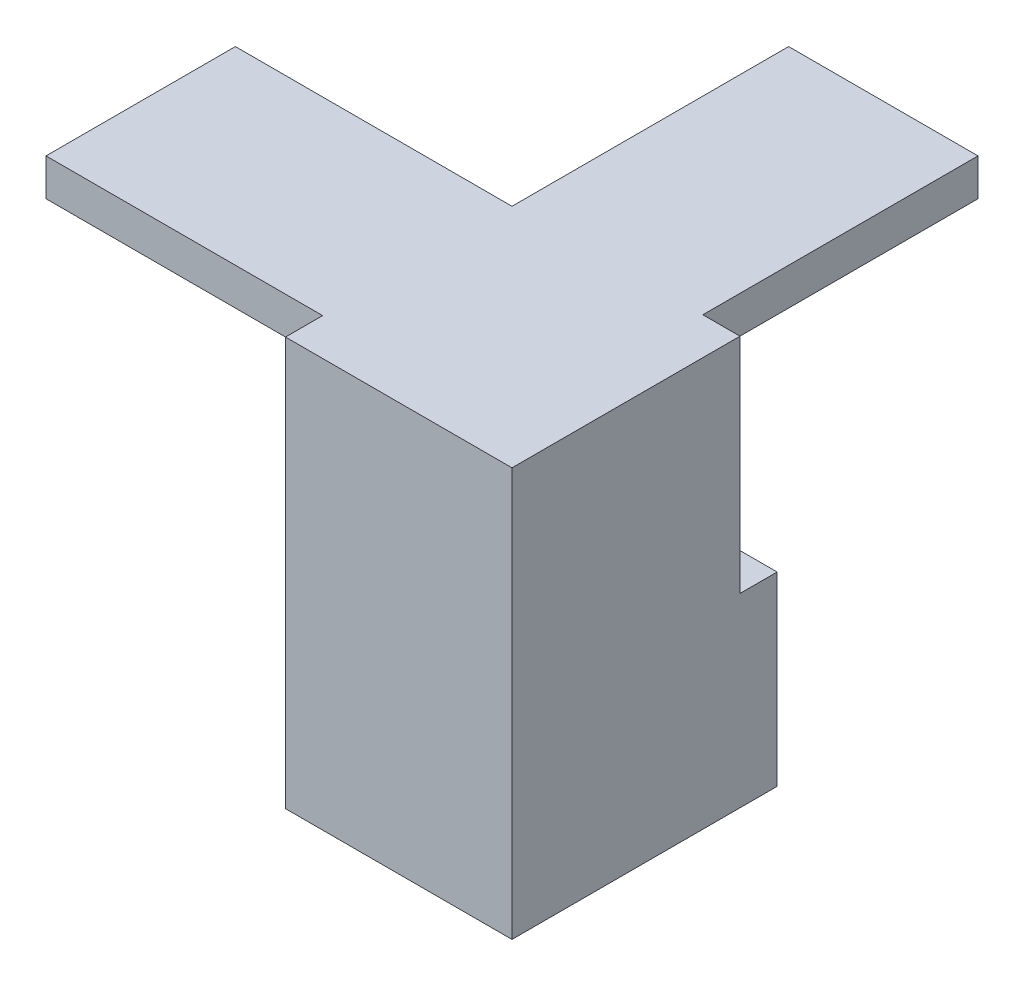
from build123d import *

# Parameters (mm, degrees)
BOSS_EXTRUDE1_DEPTH = 5
BOSS_EXTRUDE2_DEPTH = 5
SKETCH4_W           = 30.7
SKETCH4_H           = 55
BOSS_EXTRUDE3_DEPTH = 5
SKETCH5_W           = 35.5
SKETCH5_H           = 25
BOSS_EXTRUDE4_DEPTH = 5


with BuildPart() as part:
    # Sketch2 → Boss-Extrude1 (new body)
    with BuildSketch(Plane(origin=(0, 0, 0), x_dir=(1, 0, 0), z_dir=(0, 1, 0))):
        Polygon((-12.75, 12.75), (-12.75, 50), (12.75, 50), (12.75, -12.75), (-50, -12.75), (-50, 12.75), align=None)
    extrude(amount=BOSS_EXTRUDE1_DEPTH)

    # Sketch3 → Boss-Extrude2 (add)
    with BuildSketch(Plane.XY.offset(12.75)):
        Polygon((12.75, 0), (12.75, -50), (-12.75, -50), (-12.75, 0), (-12.75, 5), (12.75, 5), align=None)
    extrude(amount=BOSS_EXTRUDE2_DEPTH)

    # Sketch4 → Boss-Extrude3 (add)
    with BuildSketch(Plane(origin=(12.75, 0, 0), x_dir=(0, 0, -1), z_dir=(1, 0, 0))):
        with Locations((-2.4, -22.5)):
            Rectangle(SKETCH4_W, SKETCH4_H)
    extrude(amount=BOSS_EXTRUDE3_DEPTH)

    # Sketch5 → Boss-Extrude4 (add)
    with BuildSketch(Plane(origin=(0, 0, -12.95), x_dir=(-1, 0, 0), z_dir=(0, 0, -1))):
        with Locations((0, -37.5)):
            Rectangle(SKETCH5_W, SKETCH5_H)
    extrude(amount=BOSS_EXTRUDE4_DEPTH)


solid = part.part
